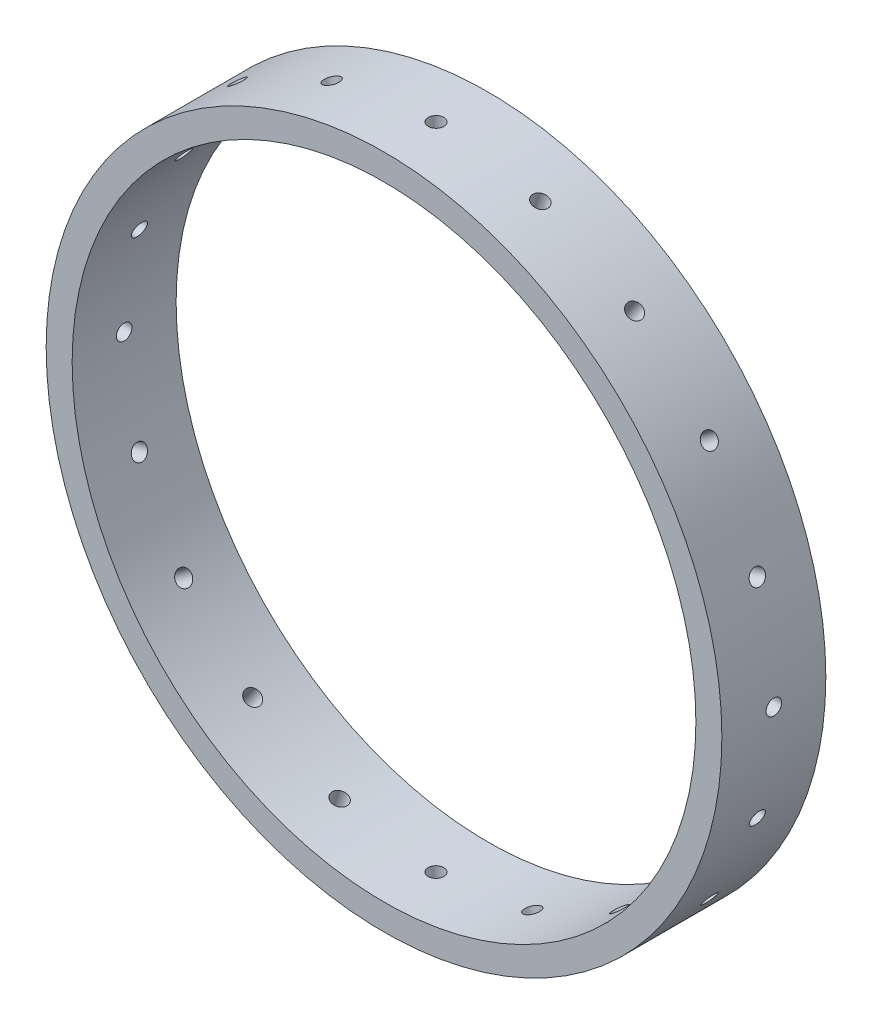
from build123d import *

# Parameters (mm, degrees)
SKETCH1_R           = 65
BOSS_EXTRUDE1_DEPTH = 10
SKETCH2_R           = 60
CUT_EXTRUDE1_DEPTH  = 20
SKETCH6_R           = 1.5
CUT_EXTRUDE2_DEPTH  = 20
CIRPATTERN1_COUNT   = 20


with BuildPart() as part:
    # Sketch1 → Boss-Extrude1 (new, symmetric)
    with BuildSketch(Plane.XY):
        Circle(SKETCH1_R)
    extrude(amount=BOSS_EXTRUDE1_DEPTH, both=True)

    # Sketch2 → Cut-Extrude1 (cut)
    with BuildSketch(Plane.XY.offset(10)):
        Circle(SKETCH2_R)
    extrude(amount=-CUT_EXTRUDE1_DEPTH, mode=Mode.SUBTRACT)

    # Sketch6 → Cut-Extrude2 (cut)
    with BuildSketch(Plane(origin=(0, 65, 0), x_dir=(1, 0, 0), z_dir=(0, 1, 0))):
        with Locations(Location((0, 0, 0), (0, 0, 270))):
            Circle(SKETCH6_R)
    cut_extrude2 = extrude(amount=-CUT_EXTRUDE2_DEPTH, mode=Mode.SUBTRACT)

    # CirPattern1: Cut-Extrude2 ×20 about axis
    cirpattern1_axis = Axis((0, 0, 10), (0, 0, -1))
    for i in range(1, CIRPATTERN1_COUNT):
        add(cut_extrude2.rotate(cirpattern1_axis, i * 360 / CIRPATTERN1_COUNT), mode=Mode.SUBTRACT)


solid = part.part
